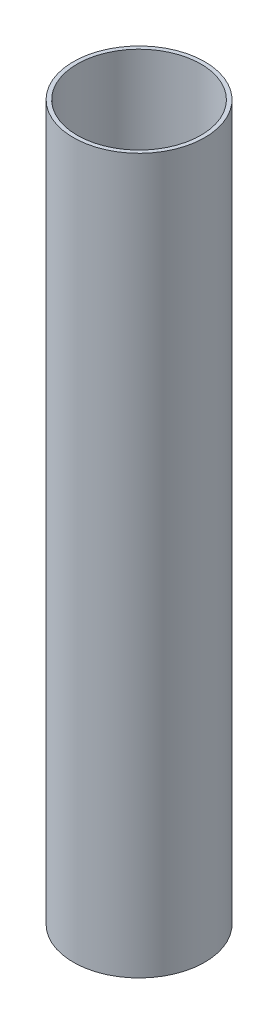
from build123d import *

# Parameters (mm, degrees)
SKETCH1_W          = 13.35
SKETCH1_H          = 145
SKETCH2_R          = 12.55
CUT_EXTRUDE1_DEPTH = 158


with BuildPart() as part:
    # Sketch1 → Revolve1 (revolve)
    with BuildSketch(Plane.XY, mode=Mode.PRIVATE) as revolve1_sk:
        with Locations((-6.675, 108.28737529)):
            Rectangle(SKETCH1_W, SKETCH1_H)
    revolve(revolve1_sk.sketch.rotate(Axis((0, 0, 0), (0, 1, 0)), 270), axis=Axis((0, 0, 0), (0, 1, 0)))

    # Sketch2 → Cut-Extrude1 (cut)
    with BuildSketch(Plane(origin=(0, 180.78737529, 0), x_dir=(1, 0, 0), z_dir=(0, 1, 0))):
        with Locations(Location((0, 0, 0), (0, 0, 270))):
            Circle(SKETCH2_R)
    extrude(amount=-CUT_EXTRUDE1_DEPTH, mode=Mode.SUBTRACT)


solid = part.part
